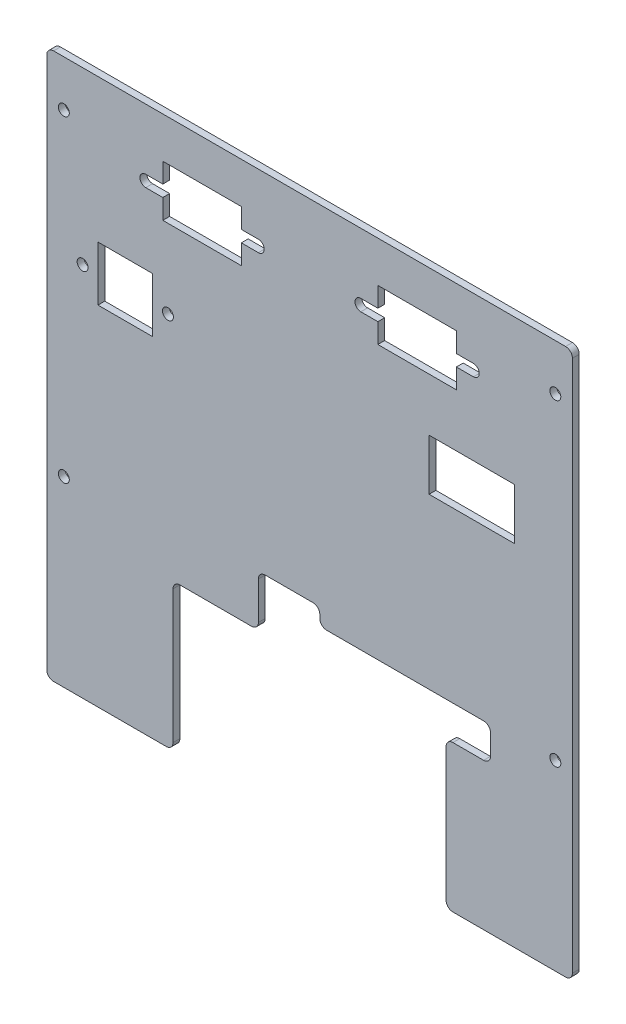
from build123d import *

# Parameters (mm, degrees)
EXTRUDE_1_DEPTH     = 2
CUT_EXTRUDE_2_REACH = 124.303
SKETCH_3_R          = 1.6
SKETCH_3_W          = 16
SKETCH_3_H          = 16
CUT_EXTRUDE_4_REACH = 124.303
SKETCH_5_R          = 1.6
FILLET_1_R          = 2
SKETCH_6_W          = 25
SKETCH_6_H          = 15
CUT_EXTRUDE_5_DEPTH = 123.302902664
CUT_EXTRUDE_6_DEPTH = 123.302902664


with BuildPart() as part:
    # 草图1 → 凸台-拉伸1 (new body)
    with BuildSketch(Plane.XY):
        Polygon((-77, 65), (77, 65), (77, -65), (77, -95), (40, -95), (40, -52), (53, -52), (53, -42), (3, -42), (3, -37), (-15, -37), (-15, -52), (-40, -52), (-40, -95), (-77, -95), (-77, -65), align=None)
    extrude(amount=EXTRUDE_1_DEPTH)

    # 草图3 → 切除-拉伸2 (cut, up to next)
    with BuildSketch(Plane.XY.offset(2), mode=Mode.PRIVATE) as cut_extrude_2_sk1:
        with Locations((-66.5, 15)):
            Circle(SKETCH_3_R)
    cut_extrude_2_tool1 = extrude(cut_extrude_2_sk1.sketch, amount=-CUT_EXTRUDE_2_REACH, mode=Mode.PRIVATE) & part.part
    # 草图3 → 切除-拉伸2 (cut, up to next)
    with BuildSketch(Plane.XY.offset(2), mode=Mode.PRIVATE) as cut_extrude_2_sk2:
        with Locations(Location((-41.5, 15, 0), (0, 0, 180))):
            Circle(SKETCH_3_R)
    cut_extrude_2_tool2 = extrude(cut_extrude_2_sk2.sketch, amount=-CUT_EXTRUDE_2_REACH, mode=Mode.PRIVATE) & part.part
    # 草图3 → 切除-拉伸2 (cut, up to next)
    with BuildSketch(Plane.XY.offset(2), mode=Mode.PRIVATE) as cut_extrude_2_sk3:
        with Locations((-54, 15)):
            Rectangle(SKETCH_3_W, SKETCH_3_H)
    cut_extrude_2_tool3 = extrude(cut_extrude_2_sk3.sketch, amount=-CUT_EXTRUDE_2_REACH, mode=Mode.PRIVATE) & part.part
    add(cut_extrude_2_tool1.solids().sort_by_distance((-66.5, 15, 2))[0], mode=Mode.SUBTRACT)
    add(cut_extrude_2_tool2.solids().sort_by_distance((-41.5, 15, 2))[0], mode=Mode.SUBTRACT)
    add(cut_extrude_2_tool3.solids().sort_by_distance((-54, 15, 2))[0], mode=Mode.SUBTRACT)

    # 草图5 → 切除-拉伸4 (cut, up to next)
    with BuildSketch(Plane.XY.offset(2), mode=Mode.PRIVATE) as cut_extrude_4_sk1:
        with Locations((72, -41.5)):
            Circle(SKETCH_5_R)
    cut_extrude_4_tool1 = extrude(cut_extrude_4_sk1.sketch, amount=-CUT_EXTRUDE_4_REACH, mode=Mode.PRIVATE) & part.part
    # 草图5 → 切除-拉伸4 (cut, up to next)
    with BuildSketch(Plane.XY.offset(2), mode=Mode.PRIVATE) as cut_extrude_4_sk2:
        with Locations((72, 51.5)):
            Circle(SKETCH_5_R)
    cut_extrude_4_tool2 = extrude(cut_extrude_4_sk2.sketch, amount=-CUT_EXTRUDE_4_REACH, mode=Mode.PRIVATE) & part.part
    # 草图5 → 切除-拉伸4 (cut, up to next)
    with BuildSketch(Plane.XY.offset(2), mode=Mode.PRIVATE) as cut_extrude_4_sk3:
        with Locations(Location((-72, 51.5, 0), (0, 0, 180))):
            Circle(SKETCH_5_R)
    cut_extrude_4_tool3 = extrude(cut_extrude_4_sk3.sketch, amount=-CUT_EXTRUDE_4_REACH, mode=Mode.PRIVATE) & part.part
    # 草图5 → 切除-拉伸4 (cut, up to next)
    with BuildSketch(Plane.XY.offset(2), mode=Mode.PRIVATE) as cut_extrude_4_sk4:
        with Locations(Location((-72, -41.5, 0), (0, 0, 180))):
            Circle(SKETCH_5_R)
    cut_extrude_4_tool4 = extrude(cut_extrude_4_sk4.sketch, amount=-CUT_EXTRUDE_4_REACH, mode=Mode.PRIVATE) & part.part
    add(cut_extrude_4_tool1.solids().sort_by_distance((72, -41.5, 2))[0], mode=Mode.SUBTRACT)
    add(cut_extrude_4_tool2.solids().sort_by_distance((72, 51.5, 2))[0], mode=Mode.SUBTRACT)
    add(cut_extrude_4_tool3.solids().sort_by_distance((-72, 51.5, 2))[0], mode=Mode.SUBTRACT)
    add(cut_extrude_4_tool4.solids().sort_by_distance((-72, -41.5, 2))[0], mode=Mode.SUBTRACT)

    # 圆角1
    fillet_1_edges = [part.edges().sort_by_distance(p)[0] for p in [
        (77, -95, 1),
        (40, -95, 1),
        (40, -52, 1),
        (53, -52, 1),
        (53, -42, 1),
        (3, -42, 1),
        (3, -37, 1),
        (-15, -37, 1),
        (-15, -52, 1),
        (-40, -52, 1),
        (-40, -95, 1),
        (-77, -95, 1),
        (-77, 65, 1),
        (77, 65, 1),
    ]]
    fillet(fillet_1_edges, radius=FILLET_1_R)

    # 草图6 → 切除-拉伸5 (cut, through all)
    with BuildSketch(Plane.XY.offset(2)):
        with Locations((47.5, 15)):
            Rectangle(SKETCH_6_W, SKETCH_6_H)
    extrude(amount=-CUT_EXTRUDE_5_DEPTH, mode=Mode.SUBTRACT)

    # 草图7 → 切除-拉伸6 (cut, through all)
    with BuildSketch(Plane.XY.offset(2)):
        with BuildLine():
            Line((-43, 53), (-20, 53))
            Line((-20, 53), (-20, 47.2))
            Line((-20, 47.2), (-15, 47.2))
            ThreePointArc((-15, 47.2), (-13.3, 45.5), (-15, 43.8))
            Line((-15, 43.8), (-20, 43.8))
            Line((-20, 43.8), (-20, 38))
            Line((-20, 38), (-43, 38))
            Line((-43, 38), (-43, 43.8))
            Line((-43, 43.8), (-48, 43.8))
            ThreePointArc((-48, 43.8), (-49.7, 45.5), (-48, 47.2))
            Line((-48, 47.2), (-43, 47.2))
            Line((-43, 47.2), (-43, 53))
        make_face()
        with BuildLine():
            Line((20, 43.8), (20, 38))
            Line((20, 38), (43, 38))
            Line((43, 38), (43, 43.8))
            Line((43, 43.8), (48, 43.8))
            ThreePointArc((48, 43.8), (49.7, 45.5), (48, 47.2))
            Line((48, 47.2), (43, 47.2))
            Line((43, 47.2), (43, 53))
            Line((43, 53), (20, 53))
            Line((20, 53), (20, 47.2))
            Line((20, 47.2), (15, 47.2))
            ThreePointArc((15, 47.2), (13.3, 45.5), (15, 43.8))
            Line((15, 43.8), (20, 43.8))
        make_face()
    extrude(amount=-CUT_EXTRUDE_6_DEPTH, mode=Mode.SUBTRACT)


solid = part.part
